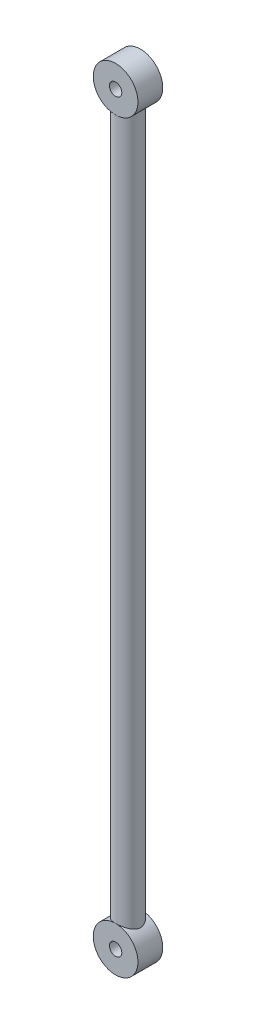
from build123d import *

# Parameters (mm, degrees)
SKETCH_1_R          = 5
EXTRUDE_1_DEPTH     = 150
SKETCH_2_R          = 9
EXTRUDE_2_DEPTH     = 5
CUT_EXTRUDE_1_REACH = 161.568
SKETCH_3_R          = 2.5


with BuildPart() as part:
    # 草图1 → 凸台-拉伸1 (new, symmetric)
    with BuildSketch(Plane(origin=(0, 0, 0), x_dir=(1, 0, 0), z_dir=(0, 1, 0))):
        with Locations(Location((0, 0, 0), (0, 0, 270))):
            Circle(SKETCH_1_R)
    extrude(amount=EXTRUDE_1_DEPTH, both=True)

    # 草图2 → 凸台-拉伸2 (add, symmetric)
    with BuildSketch(Plane.XY):
        with Locations((0, 150)):
            Circle(SKETCH_2_R)
        with Locations((0, -150)):
            Circle(SKETCH_2_R)
    extrude(amount=EXTRUDE_2_DEPTH, both=True)

    # 草图3 → 切除-拉伸1 (cut, up to next)
    with BuildSketch(Plane.XY.offset(5), mode=Mode.PRIVATE) as cut_extrude_1_sk1:
        with Locations((0, 150)):
            Circle(SKETCH_3_R)
    cut_extrude_1_tool1 = extrude(cut_extrude_1_sk1.sketch, amount=-CUT_EXTRUDE_1_REACH, mode=Mode.PRIVATE) & part.part
    # 草图3 → 切除-拉伸1 (cut, up to next)
    with BuildSketch(Plane.XY.offset(5), mode=Mode.PRIVATE) as cut_extrude_1_sk2:
        with Locations((0, -150)):
            Circle(SKETCH_3_R)
    cut_extrude_1_tool2 = extrude(cut_extrude_1_sk2.sketch, amount=-CUT_EXTRUDE_1_REACH, mode=Mode.PRIVATE) & part.part
    add(cut_extrude_1_tool1.solids().sort_by_distance((0, 150, 5))[0], mode=Mode.SUBTRACT)
    add(cut_extrude_1_tool2.solids().sort_by_distance((0, -150, 5))[0], mode=Mode.SUBTRACT)


solid = part.part
